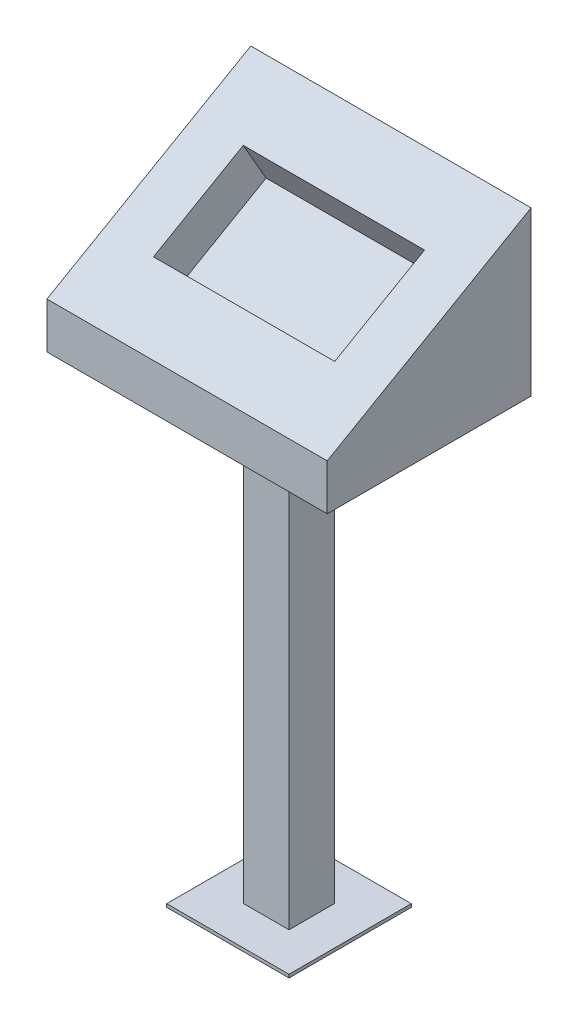
from build123d import *

# Parameters (mm, degrees)
CROQUIS1_W              = 240
CROQUIS1_H              = 240
SALIENTE_EXTRUIR1_DEPTH = 6.35
CROQUIS2_W              = 88.9
CROQUIS2_H              = 88.9
SALIENTE_EXTRUIR2_DEPTH = 900
CROQUIS3_W              = 550
CROQUIS3_H              = 400
SALIENTE_EXTRUIR3_DEPTH = 320
CORTAR_EXTRUIR1_DEPTH   = 550
CROQUIS6_W              = 355.6
CROQUIS6_H              = 203.2
CORTAR_EXTRUIR2_DEPTH   = 90


with BuildPart() as part:
    # Croquis1 → Saliente-Extruir1 (new body)
    with BuildSketch(Plane(origin=(0, 0, 0), x_dir=(1, 0, 0), z_dir=(0, 1, 0))):
        with Locations((120, 120)):
            Rectangle(CROQUIS1_W, CROQUIS1_H)
    extrude(amount=SALIENTE_EXTRUIR1_DEPTH)

    # Croquis2 → Saliente-Extruir2 (add)
    with BuildSketch(Plane(origin=(0, 6.35, 0), x_dir=(1, 0, 0), z_dir=(0, 1, 0))):
        with Locations((120, 120)):
            Rectangle(CROQUIS2_W, CROQUIS2_H)
    extrude(amount=SALIENTE_EXTRUIR2_DEPTH)

    # Croquis3 → Saliente-Extruir3 (add)
    with BuildSketch(Plane(origin=(0, 906.35, 0), x_dir=(1, 0, 0), z_dir=(0, 1, 0))):
        with Locations((120, 120)):
            Rectangle(CROQUIS3_W, CROQUIS3_H)
    extrude(amount=SALIENTE_EXTRUIR3_DEPTH)

    # Croquis4 → Cortar-Extruir1 (cut)
    with BuildSketch(Plane.ZY.offset(155)):
        Polygon((-320, 1226.35), (80, 996.35), (80, 1226.35), align=None)
    extrude(amount=-CORTAR_EXTRUIR1_DEPTH, mode=Mode.SUBTRACT)

    # Croquis6 → Cortar-Extruir2 (cut)
    with BuildSketch(Plane(origin=(0, 783.353687177, 450.428370127), x_dir=(1, 0, 0), z_dir=(0, 0.8669063030575354, 0.4984711242580827))):
        with Locations((120, 658.004640311)):
            Rectangle(CROQUIS6_W, CROQUIS6_H)
    extrude(amount=-CORTAR_EXTRUIR2_DEPTH, mode=Mode.SUBTRACT)


solid = part.part
